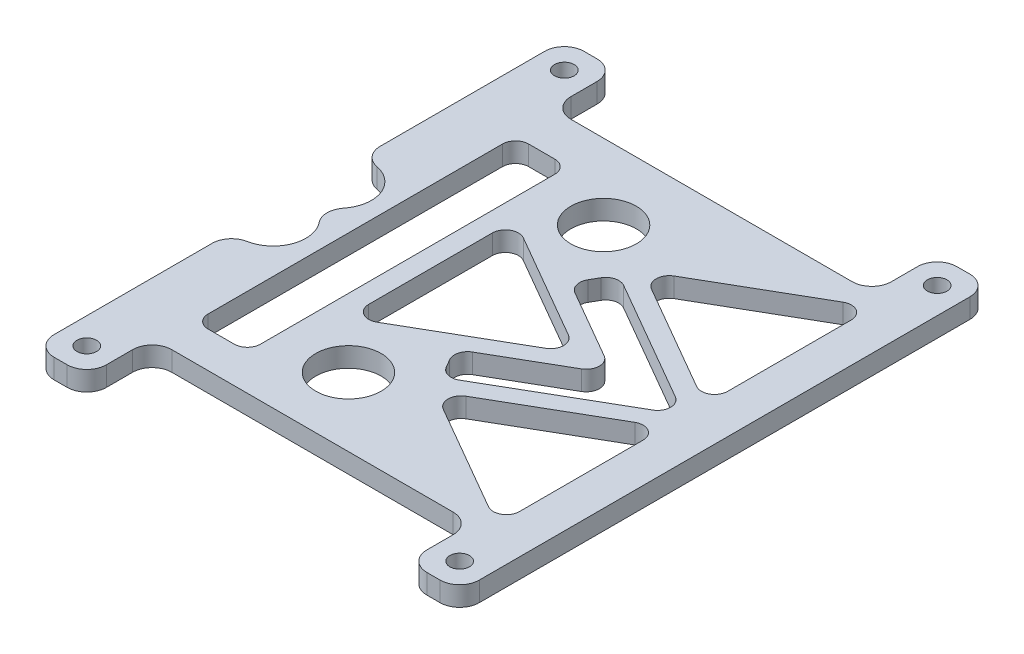
from build123d import *

# Parameters (mm, degrees)
SKETCH1_R           = 5
SKETCH1_R_2         = 1.5
BOSS_EXTRUDE1_DEPTH = 3
FILLET1_R           = 3
SKETCH2_W           = 8
SKETCH2_H           = 49
CUT_EXTRUDE1_DEPTH  = 104.979147454
FILLET2_R           = 2


with BuildPart() as part:
    # Sketch1 → Boss-Extrude1 (new body)
    with BuildSketch(Plane(origin=(0, 0, 0), x_dir=(1, 0, 0), z_dir=(0, 1, 0))):
        with BuildLine():
            Line((10.905619524, 39.769696007), (10.905619524, 61))
            Line((10.905619524, 61), (10.905619524, 71))
            Line((10.905619524, 71), (18.905619524, 71))
            Line((18.905619524, 71), (18.905619524, 61))
            Line((18.905619524, 61), (67.905619524, 61))
            Line((67.905619524, 61), (67.905619524, 71))
            Line((67.905619524, 71), (75.905619524, 71))
            Line((75.905619524, 71), (75.905619524, 61))
            Line((75.905619524, 61), (75.905619524, 0))
            Line((75.905619524, 0), (75.905619524, -10))
            Line((75.905619524, -10), (67.905619524, -10))
            Line((67.905619524, -10), (67.905619524, 0))
            Line((67.905619524, 0), (18.905619524, 0))
            Line((18.905619524, 0), (18.905619524, -10))
            Line((18.905619524, -10), (10.905619524, -10))
            Line((10.905619524, -10), (10.905619524, 0))
            Line((10.905619524, 0), (10.905619524, 20.230303993))
            ThreePointArc((10.905619524, 20.230303993), (17.347708153, 24.241211504), (12.405619524, 30))
            ThreePointArc((12.405619524, 30), (17.347708153, 35.758788496), (10.905619524, 39.769696007))
        make_face()
        with Locations(Location((38.405619524, 10.5, 0), (0, 0, 270))):
            Circle(SKETCH1_R, mode=Mode.SUBTRACT)
        with Locations(Location((38.405619524, 49.5, 0), (0, 0, 270))):
            Circle(SKETCH1_R, mode=Mode.SUBTRACT)
        with Locations(Location((14.905619524, -6, 0), (0, 0, 270))):
            Circle(SKETCH1_R_2, mode=Mode.SUBTRACT)
        with Locations(Location((14.905619524, 67, 0), (0, 0, 90))):
            Circle(SKETCH1_R_2, mode=Mode.SUBTRACT)
        with Locations(Location((71.905619524, -6, 0), (0, 0, 270))):
            Circle(SKETCH1_R_2, mode=Mode.SUBTRACT)
        with Locations(Location((71.905619524, 67, 0), (0, 0, 90))):
            Circle(SKETCH1_R_2, mode=Mode.SUBTRACT)
    extrude(amount=BOSS_EXTRUDE1_DEPTH)

    # Fillet1
    fillet1_edges = [part.edges().sort_by_distance(p)[0] for p in [
        (10.905619524, 1.5, -20.230303993),
        (12.405619524, 1.5, -30),
        (10.905619524, 1.5, -39.769696007),
        (10.905619524, 1.5, -71),
        (18.905619524, 1.5, -71),
        (18.905619524, 1.5, -61),
        (67.905619524, 1.5, -61),
        (67.905619524, 1.5, -71),
        (75.905619524, 1.5, -71),
        (75.905619524, 1.5, 10),
        (67.905619524, 1.5, 10),
        (67.905619524, 1.5, 0),
        (18.905619524, 1.5, 0),
        (18.905619524, 1.5, 10),
        (10.905619524, 1.5, 10),
    ]]
    fillet(fillet1_edges, radius=FILLET1_R)

    # Sketch2 → Cut-Extrude1 (cut, through all)
    with BuildSketch(Plane(origin=(0, 3, 0), x_dir=(1, 0, 0), z_dir=(0, 1, 0))):
        Polygon((53.314584868, 30.5), (30.951136852, 43.411542732), (30.951136852, 17.588457268), align=None)
        Polygon((69.905619524, 27.5), (69.905619524, 1.676914536), (47.542171508, 14.588457268), align=None)
        Polygon((47.542171508, 46.411542732), (69.905619524, 33.5), (69.905619524, 59.323085464), align=None)
        Polygon((69.654975177, 30.5), (46.180472316, 44.053010546), (43.457073931, 39.335946174), (58.761381637, 30.5), (43.457073931, 21.664053826), (46.180472316, 16.946989454), align=None)
        with Locations((23.951136852, 30)):
            Rectangle(SKETCH2_W, SKETCH2_H)
    extrude(amount=-CUT_EXTRUDE1_DEPTH, mode=Mode.SUBTRACT)

    # Fillet2
    fillet2_edges = [part.edges().sort_by_distance(p)[0] for p in [
        (53.314584868, 1.5, -30.5),
        (30.951136852, 1.5, -17.588457268),
        (30.951136852, 1.5, -43.411542732),
        (47.542171508, 1.5, -14.588457268),
        (69.905619524, 1.5, -27.5),
        (69.905619524, 1.5, -1.676914536),
        (47.542171508, 1.5, -46.411542732),
        (69.905619524, 1.5, -59.323085464),
        (69.905619524, 1.5, -33.5),
        (43.457073931, 1.5, -39.335946174),
        (46.180472316, 1.5, -44.053010546),
        (69.654975177, 1.5, -30.5),
        (46.180472316, 1.5, -16.946989454),
        (43.457073931, 1.5, -21.664053826),
        (58.761381637, 1.5, -30.5),
        (27.951136852, 1.5, -54.5),
        (27.951136852, 1.5, -5.5),
        (19.951136852, 1.5, -5.5),
        (19.951136852, 1.5, -54.5),
    ]]
    fillet(fillet2_edges, radius=FILLET2_R)


solid = part.part
